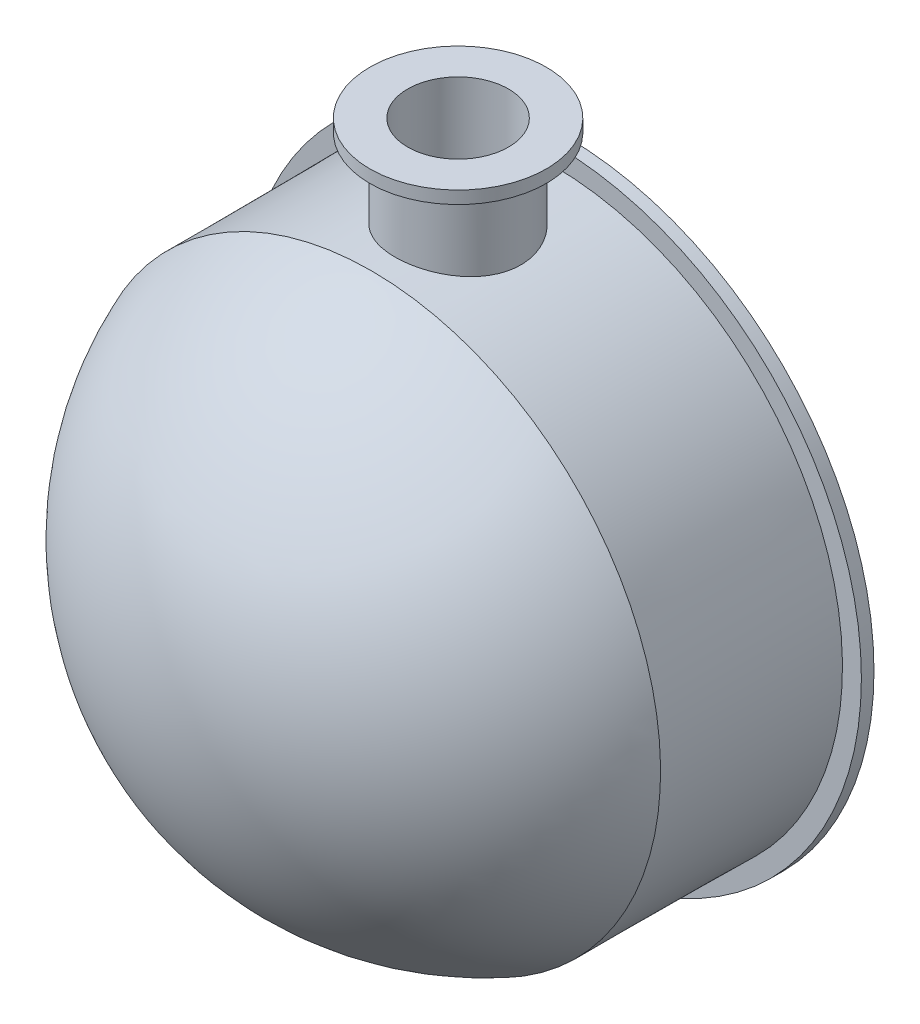
from build123d import *

# Parameters (mm, degrees)
BOSS_EXTRUDE1_REACH = 675.164
SKETCH2_R           = 50
SKETCH3_R           = 40
CUT_EXTRUDE1_DEPTH  = 104.902
SKETCH4_R           = 70
SKETCH4_R_2         = 50
BOSS_EXTRUDE2_DEPTH = 10


with BuildPart() as part:
    # Sketch1 → Revolve1 (revolve)
    with BuildSketch(Plane(origin=(0, 0, 0), x_dir=(0, 0, -1), z_dir=(1, 0, 0))):
        with BuildLine():
            Line((0, 220), (0, 245))
            Line((0, 245), (-10, 245))
            Line((-10, 245), (-10, 230))
            Line((-10, 230), (-153.65303244, 229.308885755))
            ThreePointArc((-153.65303244, 229.308885755), (-267.194002112, 138.768637803), (-310, 0))
            Line((-310, 0), (-300, 0))
            ThreePointArc((-300, 0), (-258.931728684, 133.135269557), (-150, 220))
            Line((-150, 220), (0, 220))
        make_face()
    revolve(axis=Axis((0, 0, 0), (0, 0, 1)))

    # Boss-Extrude1: up to this cone (the profile starts outside it)
    boss_extrude1_end = Plane(origin=(0, 0, 85), z_dir=(0, 0, -1)) * Cone(225.283764793, 233.994585723, 1810.606350515, mode=Mode.PRIVATE)
    # Sketch2 → Boss-Extrude1 (add, up to the surface)
    with BuildSketch(Plane(origin=(0, 300, 0), x_dir=(1, 0, 0), z_dir=(0, 1, 0)), mode=Mode.PRIVATE) as boss_extrude1_sk1:
        with Locations(Location((0, -85, 0), (0, 0, 270.000000002))):
            Circle(SKETCH2_R)
    boss_extrude1_tool1 = extrude(boss_extrude1_sk1.sketch, amount=-BOSS_EXTRUDE1_REACH, mode=Mode.PRIVATE) - boss_extrude1_end
    add(boss_extrude1_tool1.solids().sort_by_distance((0, 300, 85))[0])

    # Sketch3 → Cut-Extrude1 (cut)
    with BuildSketch(Plane(origin=(0, 300, 0), x_dir=(1, 0, 0), z_dir=(0, 1, 0))):
        with Locations(Location((0, -85, 0), (0, 0, 270))):
            Circle(SKETCH3_R)
    extrude(amount=-CUT_EXTRUDE1_DEPTH, mode=Mode.SUBTRACT)

    # Sketch4 → Boss-Extrude2 (add)
    with BuildSketch(Plane(origin=(0, 300, 0), x_dir=(1, 0, 0), z_dir=(0, 1, 0))):
        with Locations(Location((0, -85, 0), (0, 0, 270))):
            Circle(SKETCH4_R)
        with Locations(Location((0, -85, 0), (0, 0, 270))):
            Circle(SKETCH4_R_2, mode=Mode.SUBTRACT)
    extrude(amount=-BOSS_EXTRUDE2_DEPTH)


solid = part.part
